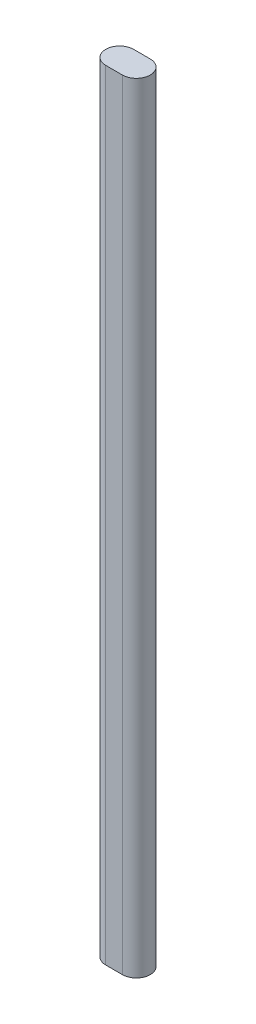
from build123d import *

# Parameters (mm, degrees)
SALIENTE_EXTRUIR1_DEPTH = 700


with BuildPart() as part:
    # Croquis1 → Saliente-Extruir1 (new body)
    with BuildSketch(Plane(origin=(0, 0, 0), x_dir=(1, 0, 0), z_dir=(0, 1, 0))):
        with BuildLine():
            Line((0, -12.5), (-15, -12.5))
            ThreePointArc((-15, -12.5), (-27.5, 0), (-15, 12.5))
            Line((-15, 12.5), (0, 12.5))
            ThreePointArc((0, 12.5), (12.5, 0), (0, -12.5))
        make_face()
    extrude(amount=-SALIENTE_EXTRUIR1_DEPTH)


solid = part.part
